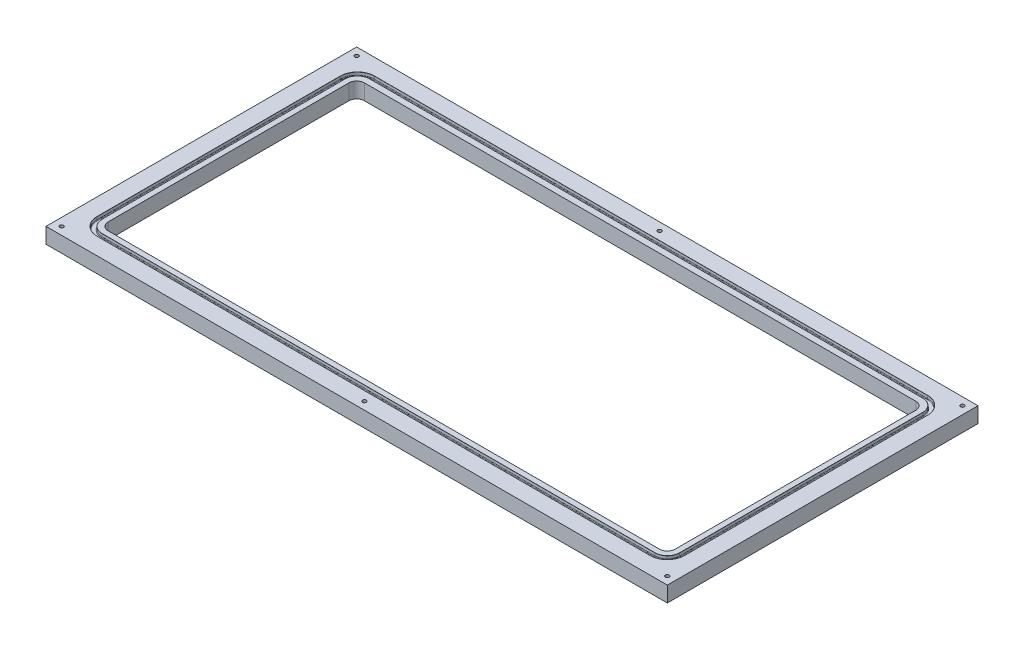
from build123d import *

# Parameters (mm, degrees)
SKETCH_1_W             = 800
SKETCH_1_H             = 400
EXTRUDE_1_DEPTH        = 20
CUT_EXTRUDE_1_DEPTH    = 4.2
FILLET_1_R             = 0.13
FILLET_2_R             = 0.7
CUT_EXTRUDE_2_DEPTH    = 895.650769854
HOLE_WIZARD_M6_1_D     = 5
HOLE_WIZARD_M6_1_DEPTH = 15
HOLE_WIZARD_M6_1_TIP   = 1.502151548


with BuildPart() as part:
    # 스케치1 → 보스-돌출1 (new body)
    with BuildSketch(Plane(origin=(0, 0, 0), x_dir=(1, 0, 0), z_dir=(0, 1, 0))):
        with Locations((400, 200)):
            Rectangle(SKETCH_1_W, SKETCH_1_H)
    extrude(amount=EXTRUDE_1_DEPTH)

    # 스케치2 → 컷-돌출1 (cut)
    with BuildSketch(Plane(origin=(0, 20, 0), x_dir=(1, 0, 0), z_dir=(0, 1, 0))):
        with BuildLine():
            Line((43.996963872, 379.05), (756.003036128, 379.05))
            ThreePointArc((756.003036128, 379.05), (771.592593786, 372.592593786), (778.05, 357.003036128))
            Line((778.05, 357.003036128), (778.05, 43.996963872))
            ThreePointArc((778.05, 43.996963872), (771.592593786, 28.407406214), (756.003036128, 21.95))
            Line((756.003036128, 21.95), (43.996963872, 21.95))
            ThreePointArc((43.996963872, 21.95), (28.407406214, 28.407406214), (21.95, 43.996963872))
            Line((21.95, 43.996963872), (21.95, 357.003036128))
            ThreePointArc((21.95, 357.003036128), (28.407406214, 372.592593786), (43.996963872, 379.05))
        make_face()
        with BuildLine():
            Line((43.996963872, 372.95), (756.003036128, 372.95))
            ThreePointArc((756.003036128, 372.95), (767.279242421, 368.279242421), (771.95, 357.003036128))
            Line((771.95, 357.003036128), (771.95, 43.996963872))
            ThreePointArc((771.95, 43.996963872), (767.279242421, 32.720757579), (756.003036128, 28.05))
            Line((756.003036128, 28.05), (43.996963872, 28.05))
            ThreePointArc((43.996963872, 28.05), (32.720757579, 32.720757579), (28.05, 43.996963872))
            Line((28.05, 43.996963872), (28.05, 357.003036128))
            ThreePointArc((28.05, 357.003036128), (32.720757579, 368.279242421), (43.996963872, 372.95))
        make_face(mode=Mode.SUBTRACT)
    extrude(amount=-CUT_EXTRUDE_1_DEPTH, mode=Mode.SUBTRACT)

    # 필렛1
    fillet_1_edges = [part.edges().sort_by_distance(p)[0] for p in [
        (28.407406214, 20, -372.592593786),
        (21.95, 20, -200.5),
        (28.407406214, 20, -28.407406214),
        (400, 20, -21.95),
        (771.592593786, 20, -28.407406214),
        (778.05, 20, -200.5),
        (771.592593786, 20, -372.592593786),
        (400, 20, -379.05),
        (32.720757579, 20, -368.279242421),
        (400, 20, -372.95),
        (767.279242421, 20, -368.279242421),
        (771.95, 20, -200.5),
        (767.279242421, 20, -32.720757579),
        (400, 20, -28.05),
        (32.720757579, 20, -32.720757579),
        (28.05, 20, -200.5),
    ]]
    fillet(fillet_1_edges, radius=FILLET_1_R)

    # 필렛2
    fillet_2_edges = [part.edges().sort_by_distance(p)[0] for p in [
        (28.407406214, 15.8, -372.592593786),
        (400, 15.8, -379.05),
        (771.592593786, 15.8, -372.592593786),
        (778.05, 15.8, -200.5),
        (771.592593786, 15.8, -28.407406214),
        (400, 15.8, -21.95),
        (28.407406214, 15.8, -28.407406214),
        (21.95, 15.8, -200.5),
        (400, 15.8, -372.95),
        (32.720757579, 15.8, -368.279242421),
        (28.05, 15.8, -200.5),
        (32.720757579, 15.8, -32.720757579),
        (400, 15.8, -28.05),
        (767.279242421, 15.8, -32.720757579),
        (771.95, 15.8, -200.5),
        (767.279242421, 15.8, -368.279242421),
    ]]
    fillet(fillet_2_edges, radius=FILLET_2_R)

    # 스케치3 → 컷-돌출2 (cut, through all)
    with BuildSketch(Plane(origin=(0, 20, 0), x_dir=(1, 0, 0), z_dir=(0, 1, 0))):
        with BuildLine():
            Line((45, 365), (755, 365))
            ThreePointArc((755, 365), (762.071067812, 362.071067812), (765, 355))
            Line((765, 355), (765, 45))
            ThreePointArc((765, 45), (762.071067812, 37.928932188), (755, 35))
            Line((755, 35), (45, 35))
            ThreePointArc((45, 35), (37.928932188, 37.928932188), (35, 45))
            Line((35, 45), (35, 355))
            ThreePointArc((35, 355), (37.928932188, 362.071067812), (45, 365))
        make_face()
    extrude(amount=-CUT_EXTRUDE_2_DEPTH, mode=Mode.SUBTRACT)

    # M6 나사 구멍1
    with Locations(Plane(origin=(0, 20, 0), x_dir=(1, 0, 0), z_dir=(0, 1, 0))):
        with Locations((10, 10), (10, 390), (790, 390), (790, 10), (400, 390), (400, 10)):
            Hole(HOLE_WIZARD_M6_1_D / 2, depth=HOLE_WIZARD_M6_1_DEPTH)
            with Locations((0, 0, -(HOLE_WIZARD_M6_1_DEPTH + HOLE_WIZARD_M6_1_TIP / 2))):  # 118° drill point
                Cone(0, HOLE_WIZARD_M6_1_D / 2, HOLE_WIZARD_M6_1_TIP, mode=Mode.SUBTRACT)


solid = part.part
